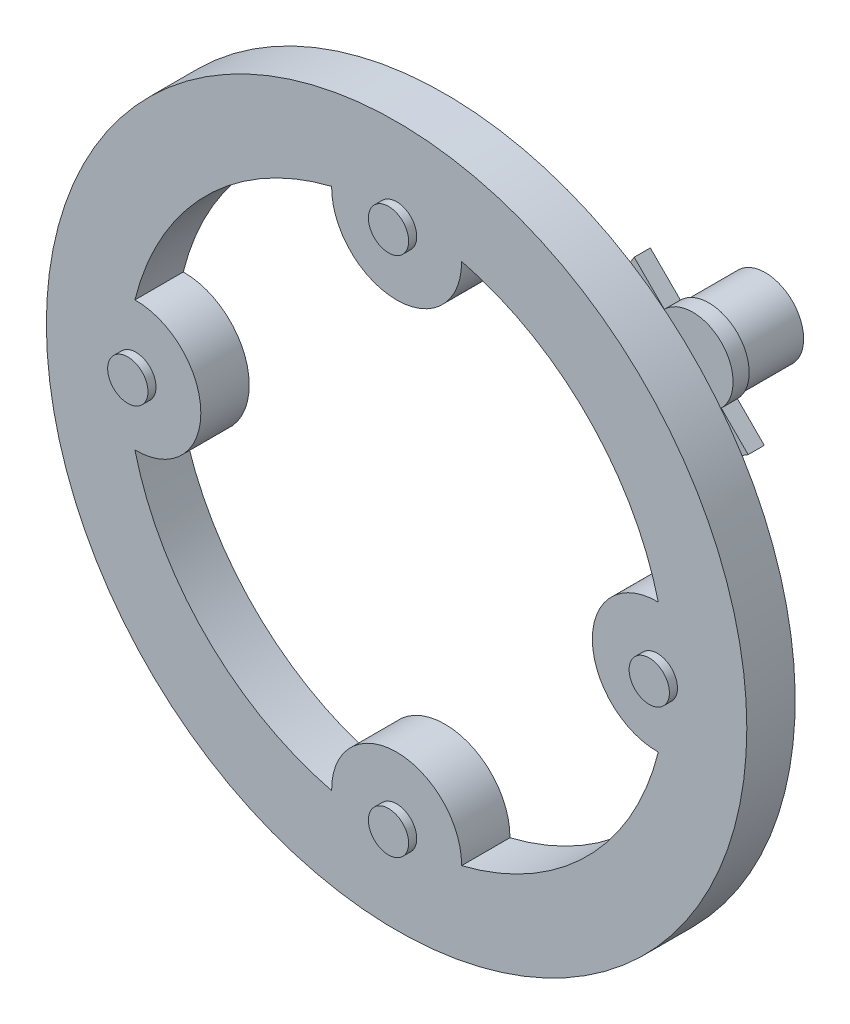
from build123d import *

# Parameters (mm, degrees)
SKETCH1_R           = 110.363
BOSS_EXTRUDE1_DEPTH = 15.24
SKETCH2_R           = 6.35
BOSS_EXTRUDE2_DEPTH = 2.54
SKETCH3_W           = 8.636
SKETCH3_H           = 8.636
BOSS_EXTRUDE3_DEPTH = 20.32
SKETCH4_W           = 8.7122
SKETCH4_H           = 8.636
BOSS_EXTRUDE4_DEPTH = 20.32
BOSS_EXTRUDE5_START = 5.08
BOSS_EXTRUDE5_DEPTH = 5.08
BOSS_EXTRUDE6_DEPTH = 5.08
SKETCH7_R           = 12.070643518
BOSS_EXTRUDE7_DEPTH = 17.78
SCALE2_SCALE        = 1.5


with BuildPart() as part:
    # Sketch1 → Boss-Extrude1 (new body)
    with BuildSketch(Plane.XY):
        Circle(SKETCH1_R)
        with BuildLine():
            ThreePointArc((-20.468919413, 82.460503922), (-60.07791345, 60.07791345), (-82.460503922, 20.468919413))
            ThreePointArc((-82.460503922, 20.468919413), (-61.684540449, 0), (-82.460503922, -20.468919413))
            ThreePointArc((-82.460503922, -20.468919413), (-60.07791345, -60.07791345), (-20.468919413, -82.460503922))
            ThreePointArc((-20.468919413, -82.460503922), (0, -61.684540449), (20.468919413, -82.460503922))
            ThreePointArc((20.468919413, -82.460503922), (60.07791345, -60.07791345), (82.460503922, -20.468919413))
            ThreePointArc((82.460503922, -20.468919413), (61.684540449, 0), (82.460503922, 20.468919413))
            ThreePointArc((82.460503922, 20.468919413), (60.07791345, 60.07791345), (20.468919413, 82.460503922))
            ThreePointArc((20.468919413, 82.460503922), (0, 61.684540449), (-20.468919413, 82.460503922))
        make_face(mode=Mode.SUBTRACT)
    extrude(amount=BOSS_EXTRUDE1_DEPTH)

    # Sketch2 → Boss-Extrude2 (add)
    with BuildSketch(Plane.XY.offset(15.24)):
        with Locations((0, 82.155728736)):
            Circle(SKETCH2_R)
        with Locations((82.155728736, 0)):
            Circle(SKETCH2_R)
        with Locations((0, -82.155728736)):
            Circle(SKETCH2_R)
        with Locations((-82.155728736, 0)):
            Circle(SKETCH2_R)
    extrude(amount=BOSS_EXTRUDE2_DEPTH)

    # Sketch3 → Boss-Extrude3 (add)
    with BuildSketch(Plane(origin=(0, 0, 0), x_dir=(-1, 0, 0), z_dir=(0, 0, -1))):
        with Locations((-82.155728736, 0)):
            Rectangle(SKETCH3_W, SKETCH3_H)
    extrude(amount=BOSS_EXTRUDE3_DEPTH)

    # Sketch4 → Boss-Extrude4 (add)
    with BuildSketch(Plane(origin=(0, 0, 0), x_dir=(-1, 0, 0), z_dir=(0, 0, -1))):
        with Locations((0, 82.155728736)):
            Rectangle(SKETCH4_W, SKETCH4_H)
    extrude(amount=BOSS_EXTRUDE4_DEPTH)

    # Sketch5 → Boss-Extrude5 (add)
    with BuildSketch(Plane(origin=(0, 0, 0), x_dir=(-1, 0, 0), z_dir=(0, 0, -1)).offset(BOSS_EXTRUDE5_START)):
        with BuildLine():
            Line((-72.079043308, 44.981361527), (-95.54887759, 59.627853106))
            Line((-95.54887759, 59.627853106), (-59.627853106, 95.54887759))
            Line((-59.627853106, 95.54887759), (-44.981361527, 72.079043308))
            ThreePointArc((-44.981361527, 72.079043308), (-60.07791345, 60.07791345), (-72.079043308, 44.981361527))
        make_face()
    extrude(amount=-BOSS_EXTRUDE5_DEPTH)

    # Sketch6 → Boss-Extrude6 (add)
    with BuildSketch(Plane(origin=(0, 0, -5.08), x_dir=(-1, 0, 0), z_dir=(0, 0, -1))):
        with BuildLine():
            Line((-87.073217452, 68.103513244), (-69.11270521, 86.064025486))
            ThreePointArc((-69.11270521, 86.064025486), (-87.073217452, 86.064025486), (-87.073217452, 68.103513244))
        make_face()
    extrude(amount=-BOSS_EXTRUDE6_DEPTH)

    # Sketch7 → Boss-Extrude7 (add)
    with BuildSketch(Plane(origin=(0, 0, -5.08), x_dir=(-1, 0, 0), z_dir=(0, 0, -1))):
        with Locations(Location((-78.092961331, 77.083769365, 0), (0, 0, 180))):
            Circle(SKETCH7_R)
    extrude(amount=BOSS_EXTRUDE7_DEPTH)


with BuildPart() as part_1:
    # Scale2: scaled about (4.191580163, 4.163736675, 6.658412252)
    add(part.part.scale(SCALE2_SCALE).moved(Location((-2.095790082, -2.081868337, -3.329206126))))


solid = part_1.part
